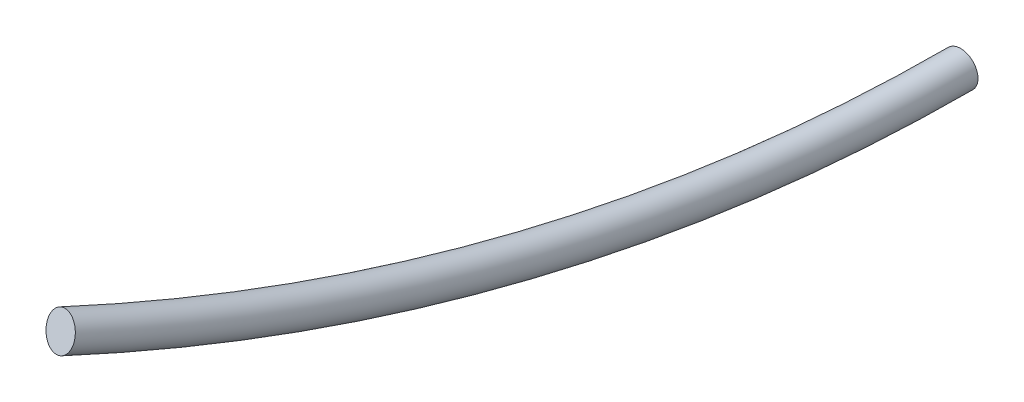
from build123d import *

# Parameters (mm, degrees)
SKETCH1_R = 50.8


with BuildPart() as part:
    # Sweep1: sweep along a path in Sketch2
    with BuildLine(Plane(origin=(-3668.091201931, -2412.953896738, 0), x_dir=(-0.2032308404109115, 0.3089446751055462, -0.929112702114121), z_dir=(-0.8354446897284507, -0.5495745358043193, 0))) as sweep1_path:
        ThreePointArc((-4335.338203333, 10892.520072969), (-5417.057618867, 10334.294193258), (-6369.931444608, 9576.821752213))
    # Sketch1 → Sweep1 (sweep)
    with BuildSketch(Plane.XY):
        with Locations((2774.885682596, -12207.350240708)):
            Circle(SKETCH1_R)
    sweep(path=sweep1_path.line)


solid = part.part
